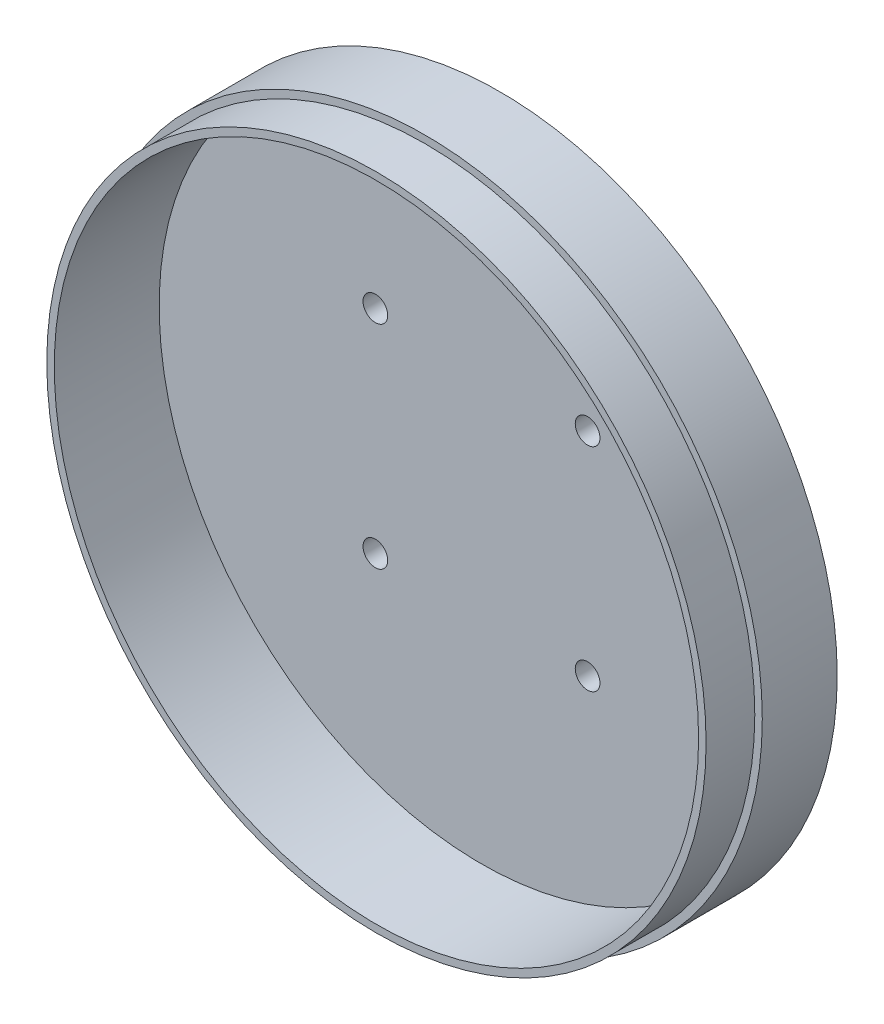
from build123d import *

# Parameters (mm, degrees)
SKETCH1_R           = 44
SKETCH1_R_2         = 43
BOSS_EXTRUDE1_DEPTH = 14
SKETCH1_4_R         = 44
SKETCH1_4_R_2       = 43
BOSS_EXTRUDE2_DEPTH = 2.5
SKETCH5_W           = 1.65
SKETCH5_H           = 2.5
CIRPATTERN1_COUNT   = 4
SKETCH6_R           = 45
SKETCH6_R_2         = 44
BOSS_EXTRUDE3_DEPTH = 10


with BuildPart() as part:
    # Sketch1 → Boss-Extrude1 (new body)
    with BuildSketch(Plane.XY):
        Circle(SKETCH1_R)
        Circle(SKETCH1_R_2, mode=Mode.SUBTRACT)
    extrude(amount=BOSS_EXTRUDE1_DEPTH)



with BuildPart() as body_2:
    # Sketch1<4> → Boss-Extrude2 (new body)
    # profile 1 of 2: a face of its own
    with BuildSketch(Plane.XY):
        Circle(SKETCH1_4_R)
        Circle(SKETCH1_4_R_2, mode=Mode.SUBTRACT)
    # profile 2 of 2: a face of its own
    with BuildSketch(Plane.XY):
        Circle(SKETCH1_4_R_2)
    extrude(amount=-BOSS_EXTRUDE2_DEPTH)

    # Sketch5 → M4x0.7 Tapped Hole1 (revolve, cut)
    with BuildSketch(Plane(origin=(-14.142135624, 14.142135624, -2.5), x_dir=(0, 1, 0), z_dir=(1, 0, 0))):
        with Locations((0.825, 1.25)):
            Rectangle(SKETCH5_W, SKETCH5_H)
    m4x0_7_tapped_hole1 = revolve(axis=Axis((-14.142135624, 14.142135624, -8.85), (0, 0, 1)), mode=Mode.SUBTRACT)

    # CirPattern1: M4x0.7 Tapped Hole1 ×4 about axis
    cirpattern1_axis = Axis((0.019915384, -0.019915384, 0), (0, 0, 1))
    for i in range(1, CIRPATTERN1_COUNT):
        add(m4x0_7_tapped_hole1.rotate(cirpattern1_axis, i * 360 / CIRPATTERN1_COUNT), mode=Mode.SUBTRACT)


with BuildPart() as part_1:
    add(part.part)

    add(body_2.part)  # Boss-Extrude3 merges body 2
    # Sketch6 → Boss-Extrude3 (add)
    with BuildSketch(Plane(origin=(0, 0, -2.5), x_dir=(-1, 0, 0), z_dir=(0, 0, -1))):
        Circle(SKETCH6_R)
        Circle(SKETCH6_R_2, mode=Mode.SUBTRACT)
    extrude(amount=-BOSS_EXTRUDE3_DEPTH)


solid = part_1.part
